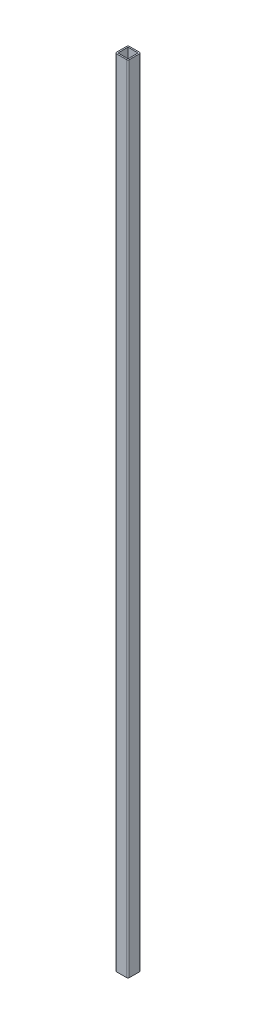
from build123d import *

# Parameters (mm, degrees)
BOSS_EXTRUDE1_DEPTH = 1580
SKETCH3_W           = 20
SKETCH3_H           = 20
CUT_EXTRUDE1_DEPTH  = 1770


with BuildPart() as part:
    # Sketch1 → Boss-Extrude1 (new body)
    with BuildSketch(Plane(origin=(0, 0, 0), x_dir=(1, 0, 0), z_dir=(0, 1, 0))):
        with BuildLine():
            Line((2.8, 0), (22.8, 0))
            ThreePointArc((22.8, 0), (24.779898987, -0.820101013), (25.6, -2.8))
            Line((25.6, -2.8), (25.6, -22.8))
            ThreePointArc((25.6, -22.8), (24.779898987, -24.779898987), (22.8, -25.6))
            Line((22.8, -25.6), (2.8, -25.6))
            ThreePointArc((2.8, -25.6), (0.820101013, -24.779898987), (0, -22.8))
            Line((0, -22.8), (0, -2.8))
            ThreePointArc((0, -2.8), (0.820101013, -0.820101013), (2.8, 0))
        make_face()
    extrude(amount=BOSS_EXTRUDE1_DEPTH)

    # Sketch3 → Cut-Extrude1 (cut)
    with BuildSketch(Plane(origin=(0, 0, 0), x_dir=(-1, 0, 0), z_dir=(0, -1, 0))):
        with Locations((-12.8, -12.8)):
            Rectangle(SKETCH3_W, SKETCH3_H)
    extrude(amount=-CUT_EXTRUDE1_DEPTH, mode=Mode.SUBTRACT)


solid = part.part
